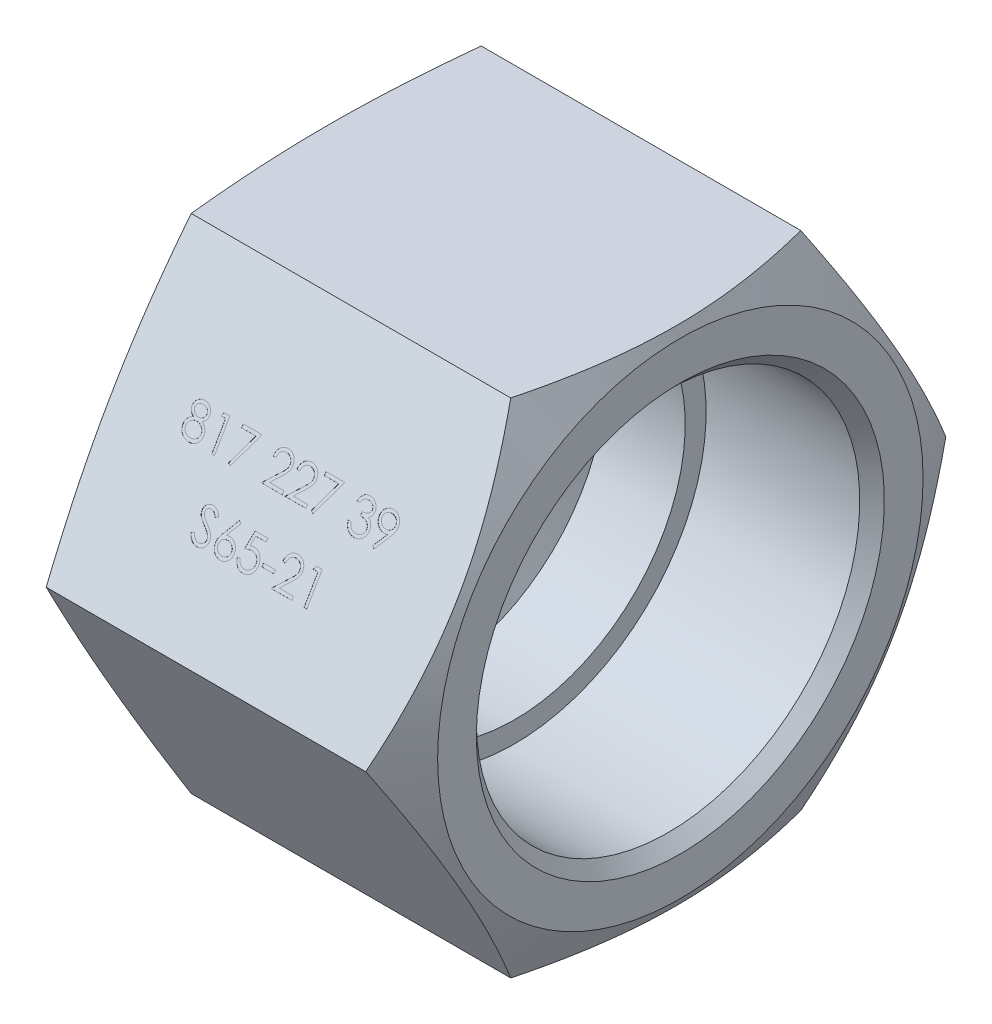
from build123d import *

# Parameters (mm, degrees)
SKETCH2_OUTSIDE_W  = 63.836
SKETCH2_OUTSIDE_H  = 63.836
EXTRUDE1_DEPTH     = 30
CHAMFER1_SIZE      = 1
SKETCH3_W          = 0.961538462
SKETCH3_H          = 0.256410256
CUT_EXTRUDE1_DEPTH = 0.01


with BuildPart() as part:
    # Sketch1 → Revolve1 (revolve)
    with BuildSketch(Plane.XY, mode=Mode.PRIVATE) as revolve1_sk:
        Polygon((0, 0), (0, 14), (2, 23.6), (28, 23.6), (30, 19.75), (30, 15.6), (16.5, 15.6), (16.5, 13.9), (10, 13.9), (4, 1), (4, 0), align=None)
    revolve(revolve1_sk.sketch.rotate(Axis((0, 0, 0), (1, 0, 0)), 90), axis=Axis((0, 0, 0), (1, 0, 0)))

    # Sketch2 outside → Extrude1 (cut)
    with BuildSketch(Plane(origin=(30, 0, 0), x_dir=(0, 0, -1), z_dir=(1, 0, 0))):
        Rectangle(SKETCH2_OUTSIDE_W, SKETCH2_OUTSIDE_H)
        Polygon((11.8, 20.438199529), (-11.8, 20.438199529), (-23.6, 0), (-11.8, -20.438199529), (11.8, -20.438199529), (23.6, 0), align=None, mode=Mode.SUBTRACT)
    extrude(amount=-EXTRUDE1_DEPTH, mode=Mode.SUBTRACT)

    # Chamfer1
    chamfer1_edges = [part.edges().sort_by_distance(p)[0] for p in [
        (30, 0, -15.6),
    ]]
    chamfer(chamfer1_edges, length=CHAMFER1_SIZE)

    # Sketch3 → Cut-Extrude1 (cut)
    # profile 1 of 14: a face of its own
    with BuildSketch(Plane(origin=(0, 10.219099765, 17.7), x_dir=(1, 0, 0), z_dir=(0, 0.49999999999999983, 0.8660254037844389))):
        with BuildLine():
            add(Edge.make_bspline(
                [(8.094256563, 1.392728365), (8.114719811, 1.382058397), (8.154629979, 1.361248395), (8.211470842, 1.327740661), (8.263417271, 1.292425686), (8.31191053, 1.256971501), (8.356098638, 1.220020321), (8.395487504, 1.181425209), (8.43105009, 1.142149534), (8.462069221, 1.10152822), (8.489352676, 1.059669185), (8.512932772, 1.016462561), (8.533087917, 0.972003037), (8.549061445, 0.925805301), (8.562219868, 0.878547972), (8.571273871, 0.829620842), (8.576143098, 0.779346312), (8.577063679, 0.745368954), (8.577529801, 0.728165064)],
                knots=[0, 0, 0, 0, 1.272397273, 2.481599622, 3.635517121, 4.734568067, 5.792894095, 6.808321871, 7.773003508, 8.711915296, 9.623354172, 10.525449501, 11.423591555, 12.311487226, 13.218079475, 14.126165749, 15.051214107, 16, 16, 16, 16], degree=3))
            add(Edge.make_bspline(
                [(8.577529801, 0.728165064), (8.576978786, 0.704095255), (8.575888121, 0.656452072), (8.566388133, 0.586133421), (8.552164577, 0.517839291), (8.531393496, 0.451584654), (8.50445536, 0.387735102), (8.47125762, 0.326235978), (8.433678188, 0.266079329), (8.403498017, 0.22906547), (8.388226916, 0.210336538)],
                knots=[0, 0, 0, 0, 1.025265484, 2.029385089, 3.018602448, 3.995076438, 4.983346944, 5.966715145, 6.97116228, 8, 8, 8, 8], degree=3))
            add(Edge.make_bspline(
                [(8.388226916, 0.210336538), (8.36834372, 0.188483843), (8.32882303, 0.145048491), (8.261120939, 0.088655055), (8.186819594, 0.041262631), (8.106206499, 0.002639849), (8.019497141, -0.027421479), (7.926709995, -0.049023277), (7.827664171, -0.061396441), (7.759588835, -0.063185005), (7.724665217, -0.064102564)],
                knots=[0, 0, 0, 0, 0.954267603, 1.896743057, 2.838368354, 3.796610408, 4.779680527, 5.799409237, 6.871065594, 8, 8, 8, 8], degree=3))
            add(Edge.make_bspline(
                [(7.724665217, -0.064102564), (7.691084225, -0.063279366), (7.625739026, -0.061677505), (7.530626256, -0.050824339), (7.441966921, -0.031804435), (7.359245515, -0.005772571), (7.282960734, 0.028091878), (7.213329947, 0.070240741), (7.149348539, 0.118977486), (7.0929582, 0.175701827), (7.042895026, 0.23645745), (6.998917845, 0.299137172), (6.962364932, 0.363746713), (6.931417007, 0.429322689), (6.907725562, 0.496784228), (6.891316841, 0.565784237), (6.880895902, 0.636202197), (6.879509377, 0.683724806), (6.878811852, 0.707632212)],
                knots=[0, 0, 0, 0, 1.256902934, 2.445805442, 3.576955095, 4.645999104, 5.686449165, 6.692658513, 7.68621702, 8.689161843, 9.678783111, 10.630372946, 11.551080876, 12.453998257, 13.34127905, 14.221779781, 15.105423033, 16, 16, 16, 16], degree=3))
            add(Edge.make_bspline(
                [(6.878811852, 0.707632212), (6.879224624, 0.725174492), (6.880040408, 0.759844229), (6.885686728, 0.811065177), (6.8947642, 0.860919559), (6.907092384, 0.909591519), (6.92380026, 0.956726714), (6.943973212, 1.002548481), (6.967496035, 1.047108551), (6.994696867, 1.090650609), (7.02634117, 1.132564547), (7.062172348, 1.173561686), (7.10290654, 1.213005876), (7.148090582, 1.251379037), (7.197208111, 1.289361876), (7.251534918, 1.324901682), (7.309630824, 1.360514514), (7.350920399, 1.381806175), (7.372101115, 1.392728365)],
                knots=[0, 0, 0, 0, 0.941657376, 1.861047343, 2.762797495, 3.66048619, 4.553285746, 5.444104102, 6.34607688, 7.256116206, 8.197091036, 9.162375105, 10.176350973, 11.237807142, 12.343728897, 13.50695164, 14.721116704, 16, 16, 16, 16], degree=3))
            add(Edge.make_bspline(
                [(7.372101115, 1.392728365), (7.343107276, 1.408538914), (7.286967088, 1.439152563), (7.212631773, 1.495400281), (7.148781327, 1.556320149), (7.097170815, 1.623198574), (7.056547795, 1.693946341), (7.028677363, 1.768120807), (7.009822732, 1.844346603), (7.007954998, 1.896422457), (7.00701698, 1.922576122)],
                knots=[0, 0, 0, 0, 1.166880483, 2.259407225, 3.286803203, 4.280235371, 5.237608625, 6.161067461, 7.076446754, 8, 8, 8, 8], degree=3))
            add(Edge.make_bspline(
                [(7.00701698, 1.922576122), (7.00818514, 1.949217235), (7.010533346, 2.002770518), (7.029521432, 2.082489178), (7.060464336, 2.160786724), (7.102550763, 2.237283662), (7.154970203, 2.309390958), (7.217860593, 2.374063063), (7.289720091, 2.430714122), (7.370189996, 2.478268531), (7.456787307, 2.516971144), (7.548155681, 2.543670018), (7.642703176, 2.561124387), (7.70705869, 2.563100569), (7.739689256, 2.564102564)],
                knots=[0, 0, 0, 0, 0.888701115, 1.786444228, 2.72001202, 3.692817113, 4.693886446, 5.687152267, 6.695133018, 7.739871481, 8.800368666, 9.853104506, 10.91144658, 12, 12, 12, 12], degree=3))
            add(Edge.make_bspline(
                [(7.739689256, 2.564102564), (7.771477695, 2.563069462), (7.834160876, 2.561032302), (7.926299896, 2.544041675), (8.014460522, 2.515663446), (8.098338736, 2.47716543), (8.176432927, 2.429746186), (8.245434576, 2.372316991), (8.306386421, 2.307930169), (8.356803845, 2.235844738), (8.398348766, 2.159641742), (8.427277981, 2.07991137), (8.445815105, 1.998376328), (8.448153223, 1.943206325), (8.449324672, 1.915564904)],
                knots=[0, 0, 0, 0, 1.072916533, 2.115669174, 3.151510826, 4.193348718, 5.225979165, 6.227137561, 7.216255879, 8.211077061, 9.189680878, 10.138522389, 11.067357538, 12, 12, 12, 12], degree=3))
            add(Edge.make_bspline(
                [(8.449324672, 1.915564904), (8.448299986, 1.888438715), (8.446287561, 1.835164423), (8.429359033, 1.757502623), (8.400849523, 1.684772595), (8.361925121, 1.616149058), (8.31119263, 1.552876559), (8.249329249, 1.494150509), (8.176828193, 1.439488489), (8.122356131, 1.408641086), (8.094256563, 1.392728365)],
                knots=[0, 0, 0, 0, 0.975232327, 1.915300861, 2.843280834, 3.77672583, 4.742871857, 5.749627742, 6.839139064, 8, 8, 8, 8], degree=3))
        make_face()
        with BuildLine():
            add(Edge.make_bspline(
                [(7.727169224, 2.307692308), (7.709632934, 2.307226993), (7.675324283, 2.306316634), (7.625018089, 2.301560465), (7.577180684, 2.292308167), (7.531312255, 2.279994802), (7.488041675, 2.263360524), (7.446781279, 2.243792661), (7.408233286, 2.220002614), (7.371932355, 2.193316044), (7.339253231, 2.163963968), (7.31024998, 2.13338274), (7.286158469, 2.100971746), (7.265700534, 2.067537203), (7.250856593, 2.032086792), (7.239739233, 1.99570738), (7.232223953, 1.957939249), (7.231660818, 1.932127455), (7.231375954, 1.919070513)],
                knots=[0, 0, 0, 0, 1.203892937, 2.355340988, 3.463153438, 4.544400666, 5.610487187, 6.640501085, 7.674077295, 8.714426146, 9.728707835, 10.68524104, 11.601827946, 12.495867327, 13.368432065, 14.231010473, 15.105153427, 16, 16, 16, 16], degree=3))
            add(Edge.make_bspline(
                [(7.231375954, 1.919070513), (7.231866931, 1.906013006), (7.232837171, 1.880209497), (7.240340834, 1.842105307), (7.251524301, 1.804661281), (7.269131917, 1.768767773), (7.290250744, 1.733179659), (7.316316084, 1.698786383), (7.347379675, 1.665468251), (7.382399276, 1.63350865), (7.420550374, 1.603580962), (7.460967548, 1.577600118), (7.503143542, 1.555861468), (7.54664502, 1.537769036), (7.591915339, 1.523704795), (7.638677106, 1.513727191), (7.686938179, 1.507525764), (7.719638594, 1.506785035), (7.736183647, 1.506410256)],
                knots=[0, 0, 0, 0, 0.873023192, 1.725219244, 2.590779336, 3.480155217, 4.391973325, 5.357036234, 6.360879153, 7.436073238, 8.526419356, 9.601555421, 10.645666583, 11.697338044, 12.750135903, 13.812665442, 14.89329948, 16, 16, 16, 16], degree=3))
            add(Edge.make_bspline(
                [(7.736183647, 1.506410256), (7.757433721, 1.507033733), (7.799723984, 1.508274528), (7.862066363, 1.519811081), (7.922682538, 1.537958165), (7.980924612, 1.562786712), (8.03528503, 1.593949469), (8.083742222, 1.631258768), (8.12588286, 1.673853123), (8.16126901, 1.721069434), (8.188704615, 1.771320569), (8.210063049, 1.821749349), (8.222535345, 1.8728938), (8.224162179, 1.907155917), (8.224965698, 1.924078526)],
                knots=[0, 0, 0, 0, 1.076279235, 2.141928126, 3.20205304, 4.278698113, 5.344010996, 6.36967002, 7.368914609, 8.37248503, 9.349703398, 10.264243087, 11.142681841, 12, 12, 12, 12], degree=3))
            add(Edge.make_bspline(
                [(8.224965698, 1.924078526), (8.224585771, 1.935955694), (8.223831671, 1.959530171), (8.217617345, 1.994343289), (8.207348893, 2.02836442), (8.193446693, 2.061874614), (8.175153982, 2.094403708), (8.153465277, 2.126463057), (8.127119205, 2.157331459), (8.097550324, 2.18772828), (8.064017889, 2.215859725), (8.026586523, 2.240598804), (7.98544813, 2.26160763), (7.940601737, 2.278671026), (7.892212506, 2.29148699), (7.84050331, 2.301084382), (7.78504299, 2.306493747), (7.746878882, 2.307284122), (7.727169224, 2.307692308)],
                knots=[0, 0, 0, 0, 0.814439003, 1.616544685, 2.417341072, 3.248991801, 4.09997495, 4.973547432, 5.9003056, 6.880240646, 7.880314356, 8.896779544, 9.951930927, 11.043077905, 12.18215768, 13.381699519, 14.647792085, 16, 16, 16, 16], degree=3))
        make_face(mode=Mode.SUBTRACT)
        with BuildLine():
            add(Edge.make_bspline(
                [(7.741692461, 1.25), (7.719459757, 1.249604542), (7.675844617, 1.24882875), (7.611946811, 1.240193392), (7.550623121, 1.228172397), (7.492080309, 1.209936084), (7.436343097, 1.186224305), (7.383109753, 1.157699634), (7.332787517, 1.12398146), (7.286071284, 1.085498163), (7.243411763, 1.044027125), (7.205984406, 1.0001256), (7.174200463, 0.954609505), (7.148605284, 0.906900769), (7.127596904, 0.858009619), (7.113801277, 0.806718479), (7.104957197, 0.754013399), (7.103769603, 0.718184757), (7.103170826, 0.700120192)],
                knots=[0, 0, 0, 0, 1.140299081, 2.23698856, 3.303958914, 4.344563908, 5.37730929, 6.408454204, 7.439741482, 8.480804886, 9.510774543, 10.48932336, 11.43758569, 12.353841022, 13.263987381, 14.161954604, 15.073269652, 16, 16, 16, 16], degree=3))
            add(Edge.make_bspline(
                [(7.103170826, 0.700120192), (7.104144583, 0.677669545), (7.106076492, 0.633127986), (7.121402663, 0.56729722), (7.145999474, 0.503567895), (7.1803032, 0.442459358), (7.222780037, 0.385352139), (7.275013228, 0.335574442), (7.333756684, 0.291344815), (7.400998008, 0.255573005), (7.474446913, 0.227005251), (7.554083862, 0.207322421), (7.638765947, 0.194292814), (7.697237084, 0.192979827), (7.727169224, 0.192307692)],
                knots=[0, 0, 0, 0, 0.898778495, 1.783155532, 2.693654817, 3.627872908, 4.583023416, 5.533784346, 6.509005473, 7.520592997, 8.575161974, 9.658835044, 10.801527049, 12, 12, 12, 12], degree=3))
            add(Edge.make_bspline(
                [(7.727169224, 0.192307692), (7.750562344, 0.192756841), (7.796139643, 0.193631927), (7.862629606, 0.201356423), (7.925375713, 0.213606155), (7.984256283, 0.231422973), (8.039930454, 0.253172957), (8.091454278, 0.281153015), (8.140153226, 0.312976103), (8.1836276, 0.350731929), (8.223222749, 0.391074425), (8.257746529, 0.433781599), (8.287716209, 0.477692765), (8.31123832, 0.523800254), (8.330042787, 0.571219479), (8.343559612, 0.620387701), (8.351899765, 0.671455724), (8.352743262, 0.706097918), (8.353170826, 0.723657853)],
                knots=[0, 0, 0, 0, 1.224942928, 2.386581632, 3.501229538, 4.569074225, 5.605009692, 6.626002462, 7.634866581, 8.645888296, 9.63523824, 10.59253846, 11.518950513, 12.414518923, 13.29783783, 14.186679152, 15.080837789, 16, 16, 16, 16], degree=3))
            add(Edge.make_bspline(
                [(8.353170826, 0.723657853), (8.352523792, 0.740713096), (8.351247952, 0.774343056), (8.343150316, 0.82417629), (8.328924689, 0.872321157), (8.30940512, 0.919356875), (8.283418718, 0.964330412), (8.252815239, 1.008413391), (8.215890869, 1.05038228), (8.174167586, 1.090563063), (8.1286969, 1.127717161), (8.080363225, 1.160584617), (8.029538609, 1.1882647), (7.976330601, 1.210776482), (7.920857347, 1.228481818), (7.863159648, 1.240850386), (7.803169952, 1.248635816), (7.762416473, 1.249540135), (7.741692461, 1.25)],
                knots=[0, 0, 0, 0, 0.917430815, 1.809013306, 2.70690318, 3.612392954, 4.541220862, 5.495268465, 6.494511384, 7.542276156, 8.608045339, 9.649016899, 10.681629292, 11.715607085, 12.752076957, 13.808767841, 14.885711793, 16, 16, 16, 16], degree=3))
        make_face(mode=Mode.SUBTRACT)
    # profile 2 of 14: a face of its own
    with BuildSketch(Plane(origin=(0, 10.219099765, 17.7), x_dir=(1, 0, 0), z_dir=(0, 0.49999999999999983, 0.8660254037844389))):
        Polygon((9.333238935, 2.5), (9.795478519, 2.5), (9.795478519, 0), (9.571119544, 0), (9.571119544, 2.243589744), (9.18650416, 2.243589744), align=None)
    # profile 3 of 14: a face of its own
    with BuildSketch(Plane(origin=(0, 10.219099765, 17.7), x_dir=(1, 0, 0), z_dir=(0, 0.49999999999999983, 0.8660254037844389))):
        Polygon((10.885222108, 2.5), (12.423683647, 2.5), (11.109581083, -0.064102564), (10.915770987, 0.042568109), (12.044076275, 2.243589744), (10.885222108, 2.243589744), align=None)
    # profile 4 of 14: a face of its own
    with BuildSketch(Plane(origin=(0, 10.219099765, 17.7), x_dir=(1, 0, 0), z_dir=(0, 0.49999999999999983, 0.8660254037844389))):
        with BuildLine():
            Line((13.930093903, 1.730769231), (13.705734929, 1.730769231))
            add(Edge.make_bspline(
                [(13.705734929, 1.730769231), (13.707197181, 1.760534151), (13.710069005, 1.818991661), (13.723517783, 1.904223023), (13.742761267, 1.985690736), (13.769969448, 2.062740675), (13.803759647, 2.136054108), (13.844281095, 2.205339834), (13.892276703, 2.27033354), (13.946710084, 2.330432714), (14.00583054, 2.385566693), (14.069620497, 2.433177581), (14.13665266, 2.473404489), (14.206723659, 2.507033947), (14.280624061, 2.532276694), (14.357683246, 2.551006437), (14.438239772, 2.562275255), (14.493125502, 2.563486531), (14.521039416, 2.564102564)],
                knots=[0, 0, 0, 0, 1.10065271, 2.161652631, 3.183658789, 4.190468796, 5.17591951, 6.163126047, 7.15150782, 8.156236427, 9.156009102, 10.134482811, 11.092018607, 12.041330605, 13.001268258, 13.972401359, 14.968799086, 16, 16, 16, 16], degree=3))
            add(Edge.make_bspline(
                [(14.521039416, 2.564102564), (14.548452326, 2.563460809), (14.602317715, 2.562199785), (14.68093344, 2.551370478), (14.755774364, 2.534409341), (14.826694198, 2.510612615), (14.893127101, 2.478623738), (14.955572133, 2.440196925), (15.014772712, 2.395754188), (15.068063272, 2.343430036), (15.116997614, 2.28757119), (15.15921351, 2.227936973), (15.19536577, 2.166344626), (15.225499827, 2.102324482), (15.247682783, 2.035273748), (15.264524361, 1.966168603), (15.274043942, 1.894293738), (15.275504959, 1.845646198), (15.276247749, 1.820913462)],
                knots=[0, 0, 0, 0, 1.111607364, 2.184268762, 3.212621178, 4.221274766, 5.211760367, 6.196651075, 7.1921475, 8.207485113, 9.220403448, 10.201281604, 11.166441695, 12.114753415, 13.065576456, 14.026450734, 14.996634279, 16, 16, 16, 16], degree=3))
            add(Edge.make_bspline(
                [(15.276247749, 1.820913462), (15.275038276, 1.78609358), (15.272640553, 1.717064856), (15.252130285, 1.615625668), (15.220097062, 1.517344654), (15.181527522, 1.438246581), (15.142618633, 1.374508372), (15.107556128, 1.322030725), (15.066509834, 1.265526819), (15.018882336, 1.205185864), (14.965658855, 1.140535217), (14.90635731, 1.071613935), (14.840554823, 0.999134099), (14.79437018, 0.949630098), (14.770438454, 0.923978365)],
                knots=[0, 0, 0, 0, 1.184426356, 2.348067706, 3.509069118, 4.696110526, 5.333549288, 6.050745305, 6.844228056, 7.710549037, 8.667450064, 9.695053472, 10.805634456, 12, 12, 12, 12], degree=3))
            Line((14.770438454, 0.923978365), (14.144937653, 0.256410256))
            Line((14.144937653, 0.256410256), (15.308299031, 0.256410256))
            Line((15.308299031, 0.256410256), (15.308299031, 0))
            Line((15.308299031, 0), (13.609581083, 0))
            Line((13.609581083, 0), (14.579132365, 1.034655449))
            add(Edge.make_bspline(
                [(14.579132365, 1.034655449), (14.602737998, 1.059297096), (14.648079589, 1.106628658), (14.712210001, 1.175730772), (14.769809278, 1.239837587), (14.821250273, 1.298827979), (14.865417063, 1.353564813), (14.904611514, 1.402275316), (14.936015508, 1.447099923), (14.970097933, 1.499057504), (15.00310792, 1.562494874), (15.031473888, 1.640018938), (15.048770209, 1.719824118), (15.050845091, 1.773754145), (15.051888775, 1.80088141)],
                knots=[0, 0, 0, 0, 1.329631726, 2.553950428, 3.673215718, 4.687767853, 5.603093632, 6.413772471, 7.123043292, 7.734684054, 8.834405432, 9.900288307, 10.943827018, 12, 12, 12, 12], degree=3))
            add(Edge.make_bspline(
                [(15.051888775, 1.80088141), (15.051434673, 1.817939552), (15.050539726, 1.851557874), (15.042641371, 1.900847702), (15.030705295, 1.948393997), (15.013601539, 1.994343011), (14.991025296, 2.038232762), (14.963544311, 2.080116677), (14.931837123, 2.120608795), (14.895157644, 2.158575436), (14.854863702, 2.193347726), (14.812296381, 2.224150644), (14.767260592, 2.249892866), (14.719946219, 2.270995364), (14.670485169, 2.287549208), (14.61878178, 2.299019622), (14.564978911, 2.306221396), (14.5282407, 2.307195804), (14.509520987, 2.307692308)],
                knots=[0, 0, 0, 0, 0.991446411, 1.95395049, 2.89581595, 3.838931463, 4.798493298, 5.75982156, 6.748411868, 7.785213223, 8.824556874, 9.840280684, 10.836137867, 11.835679398, 12.848801643, 13.863922112, 14.911575587, 16, 16, 16, 16], degree=3))
            add(Edge.make_bspline(
                [(14.509520987, 2.307692308), (14.489970392, 2.30718157), (14.451576252, 2.306178567), (14.395205514, 2.299162378), (14.341429958, 2.287058206), (14.290114313, 2.270503439), (14.241171752, 2.249461618), (14.194840292, 2.223253229), (14.151223943, 2.191979306), (14.110240712, 2.156521765), (14.072480727, 2.117044907), (14.039304387, 2.073037791), (14.010315805, 2.025303923), (13.985023496, 1.973972101), (13.964483717, 1.918576544), (13.948788609, 1.859313897), (13.936369433, 1.796441482), (13.93222049, 1.753023564), (13.930093903, 1.730769231)],
                knots=[0, 0, 0, 0, 1.031018746, 2.02475058, 2.990194455, 3.934040569, 4.864654155, 5.795059489, 6.735614925, 7.690564532, 8.649604399, 9.611025574, 10.590972636, 11.591080095, 12.624614302, 13.701020113, 14.821632451, 16, 16, 16, 16], degree=3))
        make_face()
    # profile 5 of 14: a face of its own
    with BuildSketch(Plane(origin=(0, 10.219099765, 17.7), x_dir=(1, 0, 0), z_dir=(0, 0.49999999999999983, 0.8660254037844389))):
        with BuildLine():
            Line((15.853170826, 1.730769231), (15.628811852, 1.730769231))
            add(Edge.make_bspline(
                [(15.628811852, 1.730769231), (15.630274104, 1.760534151), (15.633145928, 1.818991661), (15.646594706, 1.904223023), (15.66583819, 1.985690736), (15.693046372, 2.062740675), (15.72683657, 2.136054108), (15.767358018, 2.205339834), (15.815353626, 2.27033354), (15.869787007, 2.330432714), (15.928907464, 2.385566693), (15.99269742, 2.433177581), (16.059729583, 2.473404489), (16.129800582, 2.507033947), (16.203700984, 2.532276694), (16.280760169, 2.551006437), (16.361316695, 2.562275255), (16.416202425, 2.563486531), (16.444116339, 2.564102564)],
                knots=[0, 0, 0, 0, 1.10065271, 2.161652631, 3.183658789, 4.190468796, 5.17591951, 6.163126047, 7.15150782, 8.156236427, 9.156009102, 10.134482811, 11.092018607, 12.041330605, 13.001268258, 13.972401359, 14.968799086, 16, 16, 16, 16], degree=3))
            add(Edge.make_bspline(
                [(16.444116339, 2.564102564), (16.471529249, 2.563460809), (16.525394638, 2.562199785), (16.604010363, 2.551370478), (16.678851287, 2.534409341), (16.749771121, 2.510612615), (16.816204024, 2.478623738), (16.878649056, 2.440196925), (16.937849635, 2.395754188), (16.991140195, 2.343430036), (17.040074537, 2.28757119), (17.082290433, 2.227936973), (17.118442693, 2.166344626), (17.14857675, 2.102324482), (17.170759707, 2.035273748), (17.187601284, 1.966168603), (17.197120865, 1.894293738), (17.198581882, 1.845646198), (17.199324672, 1.820913462)],
                knots=[0, 0, 0, 0, 1.111607364, 2.184268762, 3.212621178, 4.221274766, 5.211760367, 6.196651075, 7.1921475, 8.207485113, 9.220403448, 10.201281604, 11.166441695, 12.114753415, 13.065576456, 14.026450734, 14.996634279, 16, 16, 16, 16], degree=3))
            add(Edge.make_bspline(
                [(17.199324672, 1.820913462), (17.198115199, 1.78609358), (17.195717477, 1.717064856), (17.175207208, 1.615625668), (17.143173985, 1.517344654), (17.104604445, 1.438246581), (17.065695556, 1.374508372), (17.030633051, 1.322030725), (16.989586757, 1.265526819), (16.941959259, 1.205185864), (16.888735778, 1.140535217), (16.829434233, 1.071613935), (16.763631746, 0.999134099), (16.717447103, 0.949630098), (16.693515378, 0.923978365)],
                knots=[0, 0, 0, 0, 1.184426356, 2.348067706, 3.509069118, 4.696110526, 5.333549288, 6.050745305, 6.844228056, 7.710549037, 8.667450064, 9.695053472, 10.805634456, 12, 12, 12, 12], degree=3))
            Line((16.693515378, 0.923978365), (16.068014576, 0.256410256))
            Line((16.068014576, 0.256410256), (17.231375954, 0.256410256))
            Line((17.231375954, 0.256410256), (17.231375954, 0))
            Line((17.231375954, 0), (15.532658006, 0))
            Line((15.532658006, 0), (16.502209288, 1.034655449))
            add(Edge.make_bspline(
                [(16.502209288, 1.034655449), (16.525814921, 1.059297096), (16.571156512, 1.106628658), (16.635286924, 1.175730772), (16.692886201, 1.239837587), (16.744327196, 1.298827979), (16.788493986, 1.353564813), (16.827688437, 1.402275316), (16.859092431, 1.447099923), (16.893174856, 1.499057504), (16.926184843, 1.562494874), (16.954550812, 1.640018938), (16.971847132, 1.719824118), (16.973922014, 1.773754145), (16.974965698, 1.80088141)],
                knots=[0, 0, 0, 0, 1.329631726, 2.553950428, 3.673215718, 4.687767853, 5.603093632, 6.413772471, 7.123043292, 7.734684054, 8.834405432, 9.900288307, 10.943827018, 12, 12, 12, 12], degree=3))
            add(Edge.make_bspline(
                [(16.974965698, 1.80088141), (16.974511596, 1.817939552), (16.973616649, 1.851557874), (16.965718294, 1.900847702), (16.953782218, 1.948393997), (16.936678462, 1.994343011), (16.914102219, 2.038232762), (16.886621234, 2.080116677), (16.854914046, 2.120608795), (16.818234568, 2.158575436), (16.777940625, 2.193347726), (16.735373304, 2.224150644), (16.690337515, 2.249892866), (16.643023142, 2.270995364), (16.593562092, 2.287549208), (16.541858703, 2.299019622), (16.488055834, 2.306221396), (16.451317623, 2.307195804), (16.43259791, 2.307692308)],
                knots=[0, 0, 0, 0, 0.991446411, 1.95395049, 2.89581595, 3.838931463, 4.798493298, 5.75982156, 6.748411868, 7.785213223, 8.824556874, 9.840280684, 10.836137867, 11.835679398, 12.848801643, 13.863922112, 14.911575587, 16, 16, 16, 16], degree=3))
            add(Edge.make_bspline(
                [(16.43259791, 2.307692308), (16.413047315, 2.30718157), (16.374653175, 2.306178567), (16.318282437, 2.299162378), (16.264506881, 2.287058206), (16.213191236, 2.270503439), (16.164248675, 2.249461618), (16.117917215, 2.223253229), (16.074300866, 2.191979306), (16.033317635, 2.156521765), (15.99555765, 2.117044907), (15.96238131, 2.073037791), (15.933392728, 2.025303923), (15.908100419, 1.973972101), (15.88756064, 1.918576544), (15.871865533, 1.859313897), (15.859446356, 1.796441482), (15.855297413, 1.753023564), (15.853170826, 1.730769231)],
                knots=[0, 0, 0, 0, 1.031018746, 2.02475058, 2.990194455, 3.934040569, 4.864654155, 5.795059489, 6.735614925, 7.690564532, 8.649604399, 9.611025574, 10.590972636, 11.591080095, 12.624614302, 13.701020113, 14.821632451, 16, 16, 16, 16], degree=3))
        make_face()
    # profile 6 of 14: a face of its own
    with BuildSketch(Plane(origin=(0, 10.219099765, 17.7), x_dir=(1, 0, 0), z_dir=(0, 0.49999999999999983, 0.8660254037844389))):
        Polygon((17.615991339, 2.5), (19.154452878, 2.5), (17.840350313, -0.064102564), (17.646540217, 0.042568109), (18.774845506, 2.243589744), (17.615991339, 2.243589744), align=None)
    # profile 7 of 14: a face of its own
    with BuildSketch(Plane(origin=(0, 10.219099765, 17.7), x_dir=(1, 0, 0), z_dir=(0, 0.49999999999999983, 0.8660254037844389))):
        with BuildLine():
            Line((20.660863134, 1.923076923), (20.43650416, 1.923076923))
            add(Edge.make_bspline(
                [(20.43650416, 1.923076923), (20.44258241, 1.948242983), (20.454464893, 1.997440572), (20.479248874, 2.067731473), (20.506248342, 2.134248274), (20.538669131, 2.195745469), (20.574032527, 2.253458971), (20.614548756, 2.306079774), (20.658348558, 2.354946178), (20.70679495, 2.398312776), (20.757601137, 2.437582583), (20.811483009, 2.471064767), (20.867356504, 2.499867733), (20.925608742, 2.52359647), (20.98641315, 2.541471844), (21.049220024, 2.554440991), (21.114193953, 2.562863215), (21.158299374, 2.563685189), (21.180694865, 2.564102564)],
                knots=[0, 0, 0, 0, 1.162005537, 2.271625781, 3.343758855, 4.383309926, 5.390229558, 6.379919256, 7.361854164, 8.333198761, 9.295911338, 10.242430842, 11.177959212, 12.116337295, 13.062827104, 14.020064771, 14.994644689, 16, 16, 16, 16], degree=3))
            add(Edge.make_bspline(
                [(21.180694865, 2.564102564), (21.213325395, 2.5631174), (21.277874688, 2.56116856), (21.372705436, 2.543372534), (21.464153164, 2.515211725), (21.551216913, 2.47630192), (21.632087222, 2.428310982), (21.704041641, 2.371193313), (21.766104863, 2.306050955), (21.818172275, 2.234099123), (21.858940132, 2.157202331), (21.889001827, 2.078059361), (21.907303028, 1.996857953), (21.909674854, 1.942031325), (21.910863134, 1.914563301)],
                knots=[0, 0, 0, 0, 1.083050992, 2.142477498, 3.193116406, 4.255571735, 5.30263384, 6.308962982, 7.297363603, 8.282367274, 9.249857812, 10.179914175, 11.08814088, 12, 12, 12, 12], degree=3))
            add(Edge.make_bspline(
                [(21.910863134, 1.914563301), (21.910031997, 1.888129876), (21.908405592, 1.836403766), (21.894595803, 1.760888411), (21.871355615, 1.689715839), (21.839162927, 1.622586438), (21.797490392, 1.559925838), (21.747009894, 1.501593059), (21.687365135, 1.447329374), (21.642165894, 1.416244037), (21.618895987, 1.400240385)],
                knots=[0, 0, 0, 0, 1.024540389, 2.004866551, 2.965041327, 3.920577974, 4.882998113, 5.874504559, 6.905732034, 8, 8, 8, 8], degree=3))
            add(Edge.make_bspline(
                [(21.618895987, 1.400240385), (21.645490097, 1.387398834), (21.698180721, 1.361956007), (21.770002528, 1.312059037), (21.835201011, 1.25444736), (21.87156081, 1.209488323), (21.88982948, 1.186899038)],
                knots=[0, 0, 0, 0, 1.015518401, 2.012035669, 3.001164323, 4, 4, 4, 4], degree=3))
            add(Edge.make_bspline(
                [(21.88982948, 1.186899038), (21.90185901, 1.170429216), (21.925721079, 1.137759275), (21.955175032, 1.085233257), (21.981895828, 1.03212505), (22.002717413, 0.977011189), (22.018841603, 0.920530465), (22.030367341, 0.862585896), (22.037527441, 0.803130166), (22.038552836, 0.762906966), (22.039068262, 0.742688301)],
                knots=[0, 0, 0, 0, 1.025084078, 2.033381695, 3.024893161, 4.013698104, 4.991890475, 5.976764909, 6.982997093, 8, 8, 8, 8], degree=3))
            add(Edge.make_bspline(
                [(22.039068262, 0.742688301), (22.037786467, 0.707681358), (22.035228908, 0.637832213), (22.012368855, 0.534635984), (21.976930826, 0.433760625), (21.926604443, 0.337278597), (21.865270508, 0.247006896), (21.792300991, 0.166238104), (21.708524985, 0.096810529), (21.615092379, 0.038803224), (21.513865858, -0.007566721), (21.405597578, -0.039750608), (21.29184754, -0.060712037), (21.213842327, -0.0629598), (21.174184448, -0.064102564)],
                knots=[0, 0, 0, 0, 0.955779014, 1.907060117, 2.875433937, 3.871313158, 4.872415639, 5.851225146, 6.836215519, 7.83643374, 8.849228613, 9.86973379, 10.916971861, 12, 12, 12, 12], degree=3))
            add(Edge.make_bspline(
                [(21.174184448, -0.064102564), (21.147456376, -0.063482412), (21.094864444, -0.062262159), (21.01754766, -0.053920301), (20.943746446, -0.038684583), (20.873361019, -0.018182222), (20.80632885, 0.00781188), (20.742854489, 0.040182378), (20.682547422, 0.078262023), (20.625976743, 0.1225003), (20.573149195, 0.171986971), (20.525468677, 0.227600549), (20.482140254, 0.288312981), (20.444324083, 0.354829449), (20.410297688, 0.426290348), (20.382311291, 0.503610704), (20.357678742, 0.586099291), (20.346226267, 0.643583391), (20.340350313, 0.673076923)],
                knots=[0, 0, 0, 0, 1.048658725, 2.063410685, 3.046034179, 4.001477787, 4.936774919, 5.862367409, 6.792675028, 7.730719943, 8.675894397, 9.627829632, 10.600096036, 11.597688215, 12.626045268, 13.701542398, 14.82072376, 16, 16, 16, 16], degree=3))
            Line((20.340350313, 0.673076923), (20.564709288, 0.673076923))
            add(Edge.make_bspline(
                [(20.564709288, 0.673076923), (20.570554496, 0.653827628), (20.581923934, 0.616386077), (20.601277004, 0.562500144), (20.623325769, 0.513101535), (20.646979026, 0.467827876), (20.671820773, 0.426233303), (20.699617148, 0.389417682), (20.728309394, 0.355763966), (20.749937504, 0.336803529), (20.760522589, 0.327524038)],
                knots=[0, 0, 0, 0, 1.198163088, 2.33053128, 3.407730985, 4.417276592, 5.372219308, 6.28897303, 7.162600585, 8, 8, 8, 8], degree=3))
            add(Edge.make_bspline(
                [(20.760522589, 0.327524038), (20.774520144, 0.316732371), (20.802472046, 0.295182349), (20.848020782, 0.267681185), (20.895924272, 0.243851882), (20.947220468, 0.225649242), (21.000802447, 0.210236627), (21.057536279, 0.200150542), (21.116921435, 0.19323042), (21.157469837, 0.192619754), (21.178190858, 0.192307692)],
                knots=[0, 0, 0, 0, 0.946170439, 1.889420265, 2.845303464, 3.807233317, 4.801018734, 5.828864929, 6.890507805, 8, 8, 8, 8], degree=3))
            add(Edge.make_bspline(
                [(21.178190858, 0.192307692), (21.201586217, 0.192747625), (21.247333822, 0.193607874), (21.314087293, 0.201519093), (21.377592613, 0.213040817), (21.437144703, 0.230835805), (21.493523637, 0.252822128), (21.545939101, 0.280428131), (21.595079176, 0.312817218), (21.640314466, 0.349630903), (21.680989829, 0.389931971), (21.716803767, 0.432084165), (21.747249953, 0.475909757), (21.771809652, 0.521651272), (21.791202902, 0.569119293), (21.804405188, 0.618447028), (21.813584842, 0.66923079), (21.814332422, 0.703751482), (21.814709288, 0.721153846)],
                knots=[0, 0, 0, 0, 1.217147791, 2.380027433, 3.494444702, 4.572153297, 5.609568379, 6.639424714, 7.649109417, 8.668170816, 9.669597737, 10.625200337, 11.543417969, 12.441394052, 13.322311151, 14.205496177, 15.095365482, 16, 16, 16, 16], degree=3))
            add(Edge.make_bspline(
                [(21.814709288, 0.721153846), (21.813616215, 0.74444766), (21.811435509, 0.79091938), (21.794786524, 0.859289076), (21.767401621, 0.925162942), (21.729064113, 0.987417078), (21.682395735, 1.04511415), (21.627849373, 1.09659378), (21.564972067, 1.139072417), (21.507100732, 1.168421457), (21.455839906, 1.188447939), (21.411971774, 1.2017872), (21.362859915, 1.213082668), (21.309098237, 1.223591433), (21.250281654, 1.232535254), (21.186474198, 1.239993693), (21.11766294, 1.24596158), (21.070026393, 1.248626648), (21.045478519, 1.25)],
                knots=[0, 0, 0, 0, 1.07054697, 2.135767047, 3.216561865, 4.33974944, 5.486079747, 6.621378074, 7.775625952, 8.963672916, 9.598146892, 10.304877434, 11.070270905, 11.915000392, 12.823868403, 13.805723172, 14.86925407, 16, 16, 16, 16], degree=3))
            Line((21.045478519, 1.25), (21.045478519, 1.506410256))
            add(Edge.make_bspline(
                [(21.045478519, 1.506410256), (21.076407923, 1.506935116), (21.136991027, 1.507963188), (21.225486959, 1.520397481), (21.310110754, 1.537597929), (21.388986998, 1.563944495), (21.460878936, 1.594544707), (21.52325008, 1.630153428), (21.575226614, 1.669735392), (21.616555951, 1.713901542), (21.647648257, 1.761269433), (21.670381684, 1.810638474), (21.683810488, 1.862441375), (21.685603108, 1.897794709), (21.68650416, 1.915564904)],
                knots=[0, 0, 0, 0, 1.321986639, 2.589447074, 3.816329219, 5.01088745, 6.139805852, 7.153945165, 8.075214402, 8.924034688, 9.728124013, 10.488707548, 11.240355623, 12, 12, 12, 12], degree=3))
            add(Edge.make_bspline(
                [(21.68650416, 1.915564904), (21.686208152, 1.928620436), (21.685619258, 1.954593798), (21.678192631, 1.992540276), (21.667032602, 2.029326666), (21.651689938, 2.06479653), (21.631154082, 2.098703869), (21.606578377, 2.131337761), (21.577315449, 2.162511889), (21.543782986, 2.19156926), (21.507774554, 2.219261572), (21.468310429, 2.242771313), (21.426580519, 2.262874929), (21.382538622, 2.279453144), (21.336041815, 2.291924065), (21.28730856, 2.300878237), (21.236245928, 2.306476562), (21.201408977, 2.307282573), (21.183699672, 2.307692308)],
                knots=[0, 0, 0, 0, 0.884392785, 1.759457502, 2.611959086, 3.489218968, 4.37281399, 5.2945488, 6.255912374, 7.266815255, 8.301784654, 9.332968512, 10.37626691, 11.440494194, 12.520033166, 13.637162961, 14.798855837, 16, 16, 16, 16], degree=3))
            add(Edge.make_bspline(
                [(21.183699672, 2.307692308), (21.155234195, 2.306698478), (21.099634498, 2.304757297), (21.019480986, 2.287755144), (20.944967176, 2.260627942), (20.888010985, 2.228247213), (20.845952004, 2.196282618), (20.815897048, 2.168366628), (20.786382398, 2.137343182), (20.759349771, 2.101301485), (20.732011217, 2.06268235), (20.707122244, 2.019522577), (20.68293675, 1.97294801), (20.6683635, 1.940022556), (20.660863134, 1.923076923)],
                knots=[0, 0, 0, 0, 1.472543308, 2.876219568, 4.221790263, 5.565193594, 6.249813518, 6.953379497, 7.687249741, 8.463570142, 9.283606569, 10.136032583, 11.040678096, 12, 12, 12, 12], degree=3))
        make_face()
    # profile 8 of 14: a face of its own
    with BuildSketch(Plane(origin=(0, 10.219099765, 17.7), x_dir=(1, 0, 0), z_dir=(0, 0.49999999999999983, 0.8660254037844389))):
        with BuildLine():
            Line((22.808299031, -0.064102564), (22.629012172, 0.060596955))
            Line((22.629012172, 0.060596955), (23.324124352, 1.076722756))
            add(Edge.make_bspline(
                [(23.324124352, 1.076722756), (23.279773826, 1.07129914), (23.192445169, 1.060619736), (23.104490096, 1.05865784), (23.061203679, 1.057692308)],
                knots=[0, 0, 0, 0, 1.015715272, 2, 2, 2, 2], degree=3))
            add(Edge.make_bspline(
                [(23.061203679, 1.057692308), (23.034959359, 1.058364505), (22.983444054, 1.05968397), (22.907707159, 1.070142405), (22.834931759, 1.086249639), (22.765310791, 1.110284464), (22.698582573, 1.140154613), (22.634892777, 1.177195337), (22.574327141, 1.22077126), (22.517536134, 1.270651968), (22.465884892, 1.325422005), (22.419868251, 1.383390322), (22.381624585, 1.445230301), (22.349855596, 1.509680458), (22.325762415, 1.577667137), (22.308217745, 1.648416708), (22.297416063, 1.722425024), (22.296130995, 1.772800117), (22.295478519, 1.798377404)],
                knots=[0, 0, 0, 0, 1.060718605, 2.082097864, 3.085795603, 4.069760067, 5.054557537, 6.03741023, 7.043284206, 8.066802108, 9.088538119, 10.083643548, 11.053783639, 12.022749082, 12.983451788, 13.964007469, 14.966251758, 16, 16, 16, 16], degree=3))
            add(Edge.make_bspline(
                [(22.295478519, 1.798377404), (22.296717401, 1.833355013), (22.299149075, 1.902008964), (22.318719444, 2.002318799), (22.350905401, 2.09716633), (22.395782813, 2.186302183), (22.452307614, 2.26844414), (22.520242321, 2.342450289), (22.599173724, 2.407268042), (22.687303738, 2.46298524), (22.782555895, 2.507795952), (22.882319222, 2.540824024), (22.985829308, 2.560251701), (23.055949073, 2.56281303), (23.091251756, 2.564102564)],
                knots=[0, 0, 0, 0, 1.022988612, 2.007919123, 2.978103895, 3.94594894, 4.918897164, 5.887013414, 6.875921846, 7.89917871, 8.930658928, 9.948724884, 10.967259574, 12, 12, 12, 12], degree=3))
            add(Edge.make_bspline(
                [(23.091251756, 2.564102564), (23.125886341, 2.562795305), (23.194321017, 2.560212284), (23.294956022, 2.541295163), (23.391342463, 2.509411825), (23.482946025, 2.465351422), (23.567759891, 2.410122203), (23.644028327, 2.344311829), (23.710010855, 2.267879309), (23.765599341, 2.182673245), (23.810220799, 2.091125401), (23.842415287, 1.995565456), (23.8622336, 1.896680655), (23.864730977, 1.829684603), (23.865991339, 1.795873397)],
                knots=[0, 0, 0, 0, 1.026385292, 2.028040595, 3.023318987, 4.028184125, 5.03290303, 6.015178782, 7.004435299, 8.016004309, 9.023023918, 10.015172535, 10.998308025, 12, 12, 12, 12], degree=3))
            add(Edge.make_bspline(
                [(23.865991339, 1.795873397), (23.865149618, 1.769627849), (23.863442399, 1.71639532), (23.851487894, 1.635516504), (23.831187761, 1.55305134), (23.808150834, 1.4832502), (23.785913571, 1.425601308), (23.764984191, 1.380064465), (23.741761224, 1.332134991), (23.714676392, 1.282315464), (23.685560466, 1.229970796), (23.652660982, 1.175625999), (23.616728431, 1.119208147), (23.591135774, 1.081174513), (23.578030602, 1.061698718)],
                knots=[0, 0, 0, 0, 1.179839688, 2.393009684, 3.667231171, 4.993948276, 5.694988576, 6.444077775, 7.246288328, 8.089075292, 8.993003841, 9.939041771, 10.944649915, 12, 12, 12, 12], degree=3))
            Line((23.578030602, 1.061698718), (22.808299031, -0.064102564))
        make_face()
        with BuildLine():
            add(Edge.make_bspline(
                [(23.102770185, 1.314102564), (23.122651624, 1.314645695), (23.161354026, 1.315702987), (23.218052097, 1.32213816), (23.271569385, 1.33354815), (23.322048849, 1.349919373), (23.369996636, 1.369674137), (23.414651156, 1.394825555), (23.456049781, 1.424837437), (23.494469729, 1.458558877), (23.528586872, 1.49602358), (23.558974751, 1.535235799), (23.584803728, 1.576367663), (23.605206068, 1.619934279), (23.621980765, 1.664875142), (23.633565059, 1.711913967), (23.63998244, 1.760805682), (23.641076422, 1.794019009), (23.641632365, 1.810897436)],
                knots=[0, 0, 0, 0, 1.163407946, 2.26475976, 3.333800367, 4.359385343, 5.366239384, 6.363380779, 7.350133999, 8.353570782, 9.349036268, 10.310270964, 11.253520213, 12.184142, 13.120487599, 14.056272588, 15.012232024, 16, 16, 16, 16], degree=3))
            add(Edge.make_bspline(
                [(23.641632365, 1.810897436), (23.64115403, 1.827782911), (23.640211412, 1.861057811), (23.632649055, 1.910021911), (23.619345324, 1.956945669), (23.601494978, 2.002085976), (23.577980522, 2.045071956), (23.549763746, 2.086443293), (23.516240568, 2.12593767), (23.477667307, 2.162626229), (23.436071197, 2.196446157), (23.391742269, 2.226293355), (23.3450459, 2.251308495), (23.296266979, 2.271950616), (23.245303872, 2.288059027), (23.192186738, 2.299642859), (23.136647162, 2.306051255), (23.098946244, 2.307138323), (23.079733326, 2.307692308)],
                knots=[0, 0, 0, 0, 0.972161553, 1.915763587, 2.844109794, 3.775983486, 4.705125789, 5.659731448, 6.655561913, 7.682237399, 8.721216875, 9.739758359, 10.754845918, 11.767244016, 12.7857855, 13.828538656, 14.893392813, 16, 16, 16, 16], degree=3))
            add(Edge.make_bspline(
                [(23.079733326, 2.307692308), (23.060687502, 2.307137428), (23.023319753, 2.306048758), (22.968273925, 2.29965504), (22.915515948, 2.287981123), (22.864700505, 2.271958078), (22.815923033, 2.251306955), (22.769228867, 2.226292044), (22.724889569, 2.196453028), (22.68333334, 2.162599619), (22.644691967, 2.126108443), (22.61174516, 2.08627028), (22.583463809, 2.045093476), (22.559981664, 2.002080256), (22.542122723, 1.956947195), (22.528821293, 1.910021497), (22.521258318, 1.861057919), (22.520315785, 1.827782947), (22.519837493, 1.810897436)],
                knots=[0, 0, 0, 0, 1.099389452, 2.15699305, 3.192601482, 4.213358962, 5.227959689, 6.245255729, 7.266013209, 8.307253147, 9.336162325, 10.327954924, 11.284637477, 12.215801273, 13.149702402, 14.080068371, 15.025723358, 16, 16, 16, 16], degree=3))
            add(Edge.make_bspline(
                [(22.519837493, 1.810897436), (22.520270297, 1.794005865), (22.521123867, 1.760692597), (22.529358002, 1.711745173), (22.543128202, 1.664825035), (22.561570624, 1.619475958), (22.585857474, 1.576138917), (22.615660223, 1.535019372), (22.650592756, 1.495651194), (22.690188104, 1.458646042), (22.733522505, 1.424680203), (22.779805895, 1.395015644), (22.828241492, 1.369963898), (22.8789998, 1.34986291), (22.931704657, 1.333711721), (22.986829751, 1.322159189), (23.044192778, 1.315764713), (23.08305705, 1.314661929), (23.102770185, 1.314102564)],
                knots=[0, 0, 0, 0, 0.952633368, 1.87876736, 2.791047057, 3.707742249, 4.635551637, 5.587206343, 6.568248508, 7.601284464, 8.641511608, 9.671105535, 10.699146789, 11.713763218, 12.747829548, 13.806491675, 14.887386225, 16, 16, 16, 16], degree=3))
        make_face(mode=Mode.SUBTRACT)
    # profile 9 of 14: a face of its own
    with BuildSketch(Plane(origin=(0, 10.219099765, 17.7), x_dir=(1, 0, 0), z_dir=(0, 0.49999999999999983, 0.8660254037844389))):
        with BuildLine():
            Line((10.212145185, -4.684395032), (10.423483326, -4.557692308))
            add(Edge.make_bspline(
                [(10.423483326, -4.557692308), (10.44313921, -4.59059544), (10.480799125, -4.653636571), (10.543621524, -4.738820886), (10.608716461, -4.811222426), (10.676565985, -4.870420003), (10.746755948, -4.917026351), (10.819744557, -4.950027945), (10.895285851, -4.970610784), (10.946695723, -4.973110846), (10.972361531, -4.974358974)],
                knots=[0, 0, 0, 0, 1.272034388, 2.437168799, 3.508375237, 4.49857839, 5.41946034, 6.295179144, 7.148887113, 8, 8, 8, 8], degree=3))
            add(Edge.make_bspline(
                [(10.972361531, -4.974358974), (10.994280717, -4.973748494), (11.037735555, -4.972538215), (11.101708586, -4.960909071), (11.163838445, -4.943043265), (11.222844615, -4.917456885), (11.277912911, -4.886500824), (11.326203407, -4.849110697), (11.367950631, -4.807249121), (11.402099999, -4.760547225), (11.428300024, -4.71032069), (11.448437216, -4.65876644), (11.459612268, -4.605074605), (11.461295663, -4.568924274), (11.462145185, -4.55068109)],
                knots=[0, 0, 0, 0, 1.095163259, 2.171163733, 3.241058638, 4.321873601, 5.38011039, 6.391990106, 7.366004449, 8.327778327, 9.272591725, 10.192022065, 11.087607919, 12, 12, 12, 12], degree=3))
            add(Edge.make_bspline(
                [(11.462145185, -4.55068109), (11.461092106, -4.529866197), (11.45895135, -4.487552562), (11.440857436, -4.425124238), (11.412393688, -4.363343831), (11.386134657, -4.325128642), (11.372501756, -4.305288462)],
                knots=[0, 0, 0, 0, 0.938893495, 1.908633276, 2.914225137, 4, 4, 4, 4], degree=3))
            add(Edge.make_bspline(
                [(11.372501756, -4.305288462), (11.36130846, -4.290969302), (11.337809535, -4.260908017), (11.297411312, -4.21616142), (11.250006945, -4.170005407), (11.197218691, -4.120677509), (11.137123628, -4.07047194), (11.071603975, -4.016994599), (10.998986933, -3.962279186), (10.948058721, -3.925584497), (10.921780602, -3.906650641)],
                knots=[0, 0, 0, 0, 0.722233717, 1.516239348, 2.393582979, 3.351407094, 4.387010283, 5.505090956, 6.712668013, 8, 8, 8, 8], degree=3))
            add(Edge.make_bspline(
                [(10.921780602, -3.906650641), (10.895477747, -3.887915936), (10.845188693, -3.852096605), (10.774861134, -3.798936403), (10.711972232, -3.750333639), (10.656801506, -3.705830773), (10.609373222, -3.665421769), (10.569313643, -3.62949467), (10.537643245, -3.597077841), (10.520032116, -3.576048311), (10.512125153, -3.566606571)],
                knots=[0, 0, 0, 0, 1.452282411, 2.77665338, 3.964542531, 5.026858415, 5.96415736, 6.766646006, 7.446254459, 8, 8, 8, 8], degree=3))
            add(Edge.make_bspline(
                [(10.512125153, -3.566606571), (10.501073335, -3.551891544), (10.479338452, -3.52295247), (10.450648448, -3.477720429), (10.426263332, -3.431418096), (10.40714738, -3.38392105), (10.391050081, -3.335896101), (10.380222988, -3.28671664), (10.373443418, -3.236603341), (10.372749142, -3.202879412), (10.372401595, -3.185997596)],
                knots=[0, 0, 0, 0, 1.068054152, 2.10047183, 3.106115577, 4.101338837, 5.06977816, 6.043150881, 7.020423561, 8, 8, 8, 8], degree=3))
            add(Edge.make_bspline(
                [(10.372401595, -3.185997596), (10.373333888, -3.159547757), (10.375178545, -3.107213426), (10.390778914, -3.030762833), (10.41540241, -2.957772535), (10.449898758, -2.888965154), (10.494368296, -2.82613231), (10.545829706, -2.768551248), (10.607123625, -2.720145118), (10.674375499, -2.67785079), (10.747987193, -2.644746558), (10.825123553, -2.619774429), (10.905907176, -2.60562496), (10.9606237, -2.603594413), (10.988387172, -2.602564103)],
                knots=[0, 0, 0, 0, 1.005424448, 1.989358655, 2.955360095, 3.929531133, 4.905563448, 5.876582895, 6.856512386, 7.866279853, 8.892233794, 9.918561126, 10.94386622, 12, 12, 12, 12], degree=3))
            add(Edge.make_bspline(
                [(10.988387172, -2.602564103), (11.017847244, -2.603580211), (11.076433924, -2.605600926), (11.162611935, -2.623170591), (11.245583875, -2.6522425), (11.312329064, -2.685234398), (11.364566751, -2.718185409), (11.404404417, -2.74819957), (11.444774025, -2.782753219), (11.486001207, -2.821938394), (11.527387392, -2.866114645), (11.569547001, -2.914979423), (11.612578622, -2.968234106), (11.640261379, -3.006251606), (11.654452878, -3.025741186)],
                knots=[0, 0, 0, 0, 1.286793592, 2.559021753, 3.825965368, 5.121522368, 5.803751409, 6.523245864, 7.299691795, 8.125521123, 9.008227632, 9.944561021, 10.946284179, 12, 12, 12, 12], degree=3))
            Line((11.654452878, -3.025741186), (11.451628358, -3.179487179))
            add(Edge.make_bspline(
                [(11.451628358, -3.179487179), (11.439381264, -3.163709543), (11.415796223, -3.133325505), (11.379989447, -3.090774566), (11.346240412, -3.051905652), (11.312990127, -3.018144846), (11.281994676, -2.987643322), (11.251911074, -2.96152921), (11.223172252, -2.939546642), (11.186945887, -2.916086956), (11.141433231, -2.892832311), (11.08430142, -2.873154398), (11.024596937, -2.861329354), (10.983932915, -2.859765863), (10.963347108, -2.858974359)],
                knots=[0, 0, 0, 0, 1.181633172, 2.275549214, 3.290209073, 4.226197932, 5.078386478, 5.862611352, 6.581680152, 7.217281963, 8.414376989, 9.595101626, 10.782541182, 12, 12, 12, 12], degree=3))
            add(Edge.make_bspline(
                [(10.963347108, -2.858974359), (10.937521021, -2.859839859), (10.887717844, -2.861508894), (10.817010533, -2.879737455), (10.753372015, -2.908438784), (10.698691611, -2.948663768), (10.653165199, -2.99632162), (10.620232728, -3.051163659), (10.600411182, -3.111722518), (10.597992411, -3.153966559), (10.59676057, -3.175480769)],
                knots=[0, 0, 0, 0, 1.14458467, 2.207223713, 3.21896685, 4.227309161, 5.202851033, 6.127160689, 7.046193047, 8, 8, 8, 8], degree=3))
            add(Edge.make_bspline(
                [(10.59676057, -3.175480769), (10.597041375, -3.188874682), (10.597603443, -3.215684411), (10.605442584, -3.255292569), (10.615513534, -3.294800669), (10.631472556, -3.334031085), (10.653504916, -3.373669913), (10.682437185, -3.414399726), (10.718875265, -3.456579517), (10.746787416, -3.484013356), (10.761524192, -3.498497596)],
                knots=[0, 0, 0, 0, 0.858281714, 1.717966888, 2.583508476, 3.4729293, 4.427298488, 5.488583878, 6.674047936, 8, 8, 8, 8], degree=3))
            add(Edge.make_bspline(
                [(10.761524192, -3.498497596), (10.766996601, -3.503381186), (10.779997791, -3.514983478), (10.80376631, -3.533977964), (10.835154023, -3.557408515), (10.873341309, -3.586399456), (10.919032282, -3.620029072), (10.972231965, -3.657867366), (11.032347346, -3.701142694), (11.075005857, -3.73139808), (11.097561852, -3.747395833)],
                knots=[0, 0, 0, 0, 0.420754252, 0.999615792, 1.744751191, 2.668019286, 3.750313428, 4.999500688, 6.413464383, 8, 8, 8, 8], degree=3))
            add(Edge.make_bspline(
                [(11.097561852, -3.747395833), (11.124694647, -3.767139662), (11.177233545, -3.805370849), (11.251988959, -3.86281062), (11.31977025, -3.918987598), (11.380815396, -3.973543031), (11.435727473, -4.026063098), (11.483897274, -4.077179655), (11.525815617, -4.126526493), (11.57094363, -4.189792618), (11.617056358, -4.267493393), (11.656657435, -4.362692134), (11.681627683, -4.458260935), (11.684893051, -4.522494389), (11.68650416, -4.554186699)],
                knots=[0, 0, 0, 0, 1.163667725, 2.253281268, 3.268753668, 4.215851969, 5.092017293, 5.902905408, 6.650798638, 7.335211899, 8.59617414, 9.77448103, 10.901945474, 12, 12, 12, 12], degree=3))
            add(Edge.make_bspline(
                [(11.68650416, -4.554186699), (11.686034775, -4.576599817), (11.685105122, -4.620990805), (11.674418755, -4.686173003), (11.658761851, -4.749480767), (11.635163827, -4.810131561), (11.606361571, -4.869234963), (11.569814251, -4.925240606), (11.527451619, -4.979388034), (11.478856073, -5.030233385), (11.425680428, -5.076909239), (11.369477789, -5.118429997), (11.310156165, -5.153050228), (11.248037368, -5.18130083), (11.183107127, -5.2033962), (11.115387282, -5.219405392), (11.044766202, -5.2292309), (10.996765858, -5.230250729), (10.972361531, -5.230769231)],
                knots=[0, 0, 0, 0, 0.983748083, 1.948392443, 2.894712957, 3.844097841, 4.80183111, 5.778335162, 6.776009319, 7.81870978, 8.863265674, 9.881300176, 10.883814829, 11.87499822, 12.874611388, 13.892143829, 14.928324115, 16, 16, 16, 16], degree=3))
            add(Edge.make_bspline(
                [(10.972361531, -5.230769231), (10.953479144, -5.230404101), (10.915952172, -5.22967844), (10.860445399, -5.22326324), (10.806059978, -5.214186737), (10.753478348, -5.199776687), (10.702023054, -5.182293132), (10.651917887, -5.160765752), (10.603138563, -5.134967751), (10.555411718, -5.105471305), (10.508858736, -5.071144344), (10.463916259, -5.031163275), (10.419109698, -4.986630772), (10.375761558, -4.936337512), (10.332995026, -4.881096024), (10.291653305, -4.820389465), (10.250880649, -4.754548498), (10.225298172, -4.708216294), (10.212145185, -4.684395032)],
                knots=[0, 0, 0, 0, 0.915332311, 1.819136955, 2.706846663, 3.586547465, 4.459518054, 5.340707479, 6.227863349, 7.133153174, 8.059268498, 9.028702269, 10.047606654, 11.120612155, 12.245963614, 13.433783089, 14.680604001, 16, 16, 16, 16], degree=3))
        make_face()
    # profile 10 of 14: a face of its own
    with BuildSketch(Plane(origin=(0, 10.219099765, 17.7), x_dir=(1, 0, 0), z_dir=(0, 0.49999999999999983, 0.8660254037844389))):
        with BuildLine():
            Line((13.128811852, -2.602564103), (13.301588294, -2.73828125))
            Line((13.301588294, -2.73828125), (12.641031403, -3.748397436))
            add(Edge.make_bspline(
                [(12.641031403, -3.748397436), (12.685010172, -3.741387535), (12.770795734, -3.727713932), (12.857628519, -3.725458257), (12.899945666, -3.724358974)],
                knots=[0, 0, 0, 0, 1.025318673, 2, 2, 2, 2], degree=3))
            add(Edge.make_bspline(
                [(12.899945666, -3.724358974), (12.925354592, -3.725041911), (12.975371307, -3.726386252), (13.048804737, -3.73673186), (13.119368262, -3.753035511), (13.186769414, -3.776801408), (13.251250115, -3.807160233), (13.313180398, -3.84354514), (13.37139612, -3.887834912), (13.426646962, -3.93730988), (13.476809174, -3.992107726), (13.521220643, -4.050251538), (13.558525494, -4.111680739), (13.588792581, -4.176364215), (13.612296066, -4.244202257), (13.629430098, -4.315108071), (13.639558378, -4.389130551), (13.640933729, -4.439472105), (13.641632365, -4.465044071)],
                knots=[0, 0, 0, 0, 1.04369286, 2.054478336, 3.041073146, 4.015093852, 4.984733326, 5.965804835, 6.960378782, 7.985147595, 9.009457201, 10.008161701, 10.986880575, 11.956520048, 12.937015923, 13.931873656, 14.949455224, 16, 16, 16, 16], degree=3))
            add(Edge.make_bspline(
                [(13.641632365, -4.465044071), (13.640615861, -4.500029573), (13.638615623, -4.568872763), (13.61868434, -4.669141839), (13.587713165, -4.764665065), (13.543443502, -4.85391733), (13.488456086, -4.936776308), (13.421400662, -5.010194498), (13.344655314, -5.075673096), (13.257879029, -5.130427824), (13.164491198, -5.175144289), (13.066382628, -5.207262319), (12.964506095, -5.227036226), (12.895359946, -5.229515228), (12.860382365, -5.230769231)],
                knots=[0, 0, 0, 0, 1.031375318, 2.029502543, 3.004789286, 3.987476834, 4.960371455, 5.9300674, 6.912260825, 7.929083631, 8.949397511, 9.960523116, 10.96833055, 12, 12, 12, 12], degree=3))
            add(Edge.make_bspline(
                [(12.860382365, -5.230769231), (12.826741864, -5.229677655), (12.760105923, -5.227515435), (12.662082498, -5.208254051), (12.567894629, -5.177034692), (12.478202214, -5.134024493), (12.395116062, -5.079697434), (12.320783464, -5.014295806), (12.255575054, -4.939217616), (12.201307468, -4.854474511), (12.158265516, -4.763410256), (12.125986998, -4.668455144), (12.107132539, -4.569955157), (12.104497855, -4.503182915), (12.103170826, -4.469551282)],
                knots=[0, 0, 0, 0, 1.012016664, 2.004627821, 2.994792927, 3.992885782, 4.990978636, 5.973936114, 6.964471063, 7.975201453, 8.993600317, 9.990122807, 10.98767138, 12, 12, 12, 12], degree=3))
            add(Edge.make_bspline(
                [(12.103170826, -4.469551282), (12.104014716, -4.443805151), (12.105737776, -4.391236471), (12.117768769, -4.311619308), (12.137100766, -4.23015425), (12.158750942, -4.161044112), (12.181626377, -4.104428739), (12.200663906, -4.058783388), (12.224359617, -4.011811193), (12.249626318, -3.961901453), (12.278738367, -3.91034043), (12.310392402, -3.85626638), (12.345463582, -3.800539289), (12.370049412, -3.762722007), (12.382617942, -3.743389423)],
                knots=[0, 0, 0, 0, 1.173818275, 2.396712641, 3.66331629, 4.989737886, 5.693666774, 6.447286557, 7.243889047, 8.091586357, 8.998013824, 9.943181721, 10.948533338, 12, 12, 12, 12], degree=3))
            Line((12.382617942, -3.743389423), (13.128811852, -2.602564103))
        make_face()
        with BuildLine():
            add(Edge.make_bspline(
                [(12.852870345, -3.980769231), (12.833825885, -3.981324976), (12.796626521, -3.982410509), (12.742049796, -3.98871426), (12.690397474, -4.000585021), (12.640985235, -4.01570383), (12.594736876, -4.036491729), (12.551316276, -4.061743014), (12.510555525, -4.091472427), (12.472881559, -4.125258792), (12.438724657, -4.162250245), (12.409309564, -4.201871332), (12.383936421, -4.243167191), (12.36330655, -4.286482864), (12.34724221, -4.331801793), (12.335622031, -4.378915542), (12.329155066, -4.428140046), (12.328079186, -4.461520406), (12.327529801, -4.478565705)],
                knots=[0, 0, 0, 0, 1.129588631, 2.206414736, 3.251139165, 4.268635594, 5.265702196, 6.250456724, 7.242448911, 8.251968645, 9.246821453, 10.222880186, 11.173611482, 12.116736599, 13.062300278, 14.020270554, 14.989073742, 16, 16, 16, 16], degree=3))
            add(Edge.make_bspline(
                [(12.327529801, -4.478565705), (12.327977202, -4.495458548), (12.328854489, -4.528582898), (12.336820431, -4.577396597), (12.348988347, -4.624371532), (12.36708863, -4.669265531), (12.388679264, -4.712762901), (12.417183067, -4.753288105), (12.448766486, -4.793302441), (12.486519295, -4.829732063), (12.527035983, -4.863629652), (12.570322557, -4.893258404), (12.615436814, -4.918605671), (12.662987829, -4.938470741), (12.712300961, -4.954773803), (12.763787071, -4.966246288), (12.817481968, -4.972732378), (12.85385478, -4.973809659), (12.872401595, -4.974358974)],
                knots=[0, 0, 0, 0, 0.989467248, 1.94019797, 2.891935182, 3.827694429, 4.772920941, 5.730924762, 6.725747692, 7.756678648, 8.79901574, 9.819492441, 10.826891316, 11.826466727, 12.835195252, 13.867842842, 14.912794438, 16, 16, 16, 16], degree=3))
            add(Edge.make_bspline(
                [(12.872401595, -4.974358974), (12.89094838, -4.973809616), (12.927321133, -4.972732251), (12.981016462, -4.966246773), (13.032500975, -4.954772024), (13.08181991, -4.938477188), (13.129349504, -4.918581753), (13.174424305, -4.893416096), (13.217301515, -4.863447441), (13.2578448, -4.829789992), (13.29544047, -4.793095098), (13.327781384, -4.753645296), (13.355412265, -4.712435371), (13.377865255, -4.669436878), (13.395766178, -4.624344387), (13.407995797, -4.57740387), (13.415945289, -4.528580994), (13.416824837, -4.495457905), (13.41727339, -4.478565705)],
                knots=[0, 0, 0, 0, 1.087397944, 2.132534446, 3.165364764, 4.174271784, 5.174024072, 6.181601208, 7.194203697, 8.236725232, 9.267838612, 10.269026844, 11.221737037, 12.171628256, 13.107553087, 14.05945871, 15.010357665, 16, 16, 16, 16], degree=3))
            add(Edge.make_bspline(
                [(13.41727339, -4.478565705), (13.416880324, -4.461498169), (13.416108862, -4.428000146), (13.407383185, -4.378937561), (13.395281489, -4.331562414), (13.377007896, -4.28617245), (13.353267507, -4.242946788), (13.324350787, -4.201667073), (13.290898952, -4.162016825), (13.252257852, -4.125186247), (13.210193399, -4.091509763), (13.165467981, -4.061781509), (13.118676571, -4.03669224), (13.069866612, -4.015758595), (13.018478839, -4.000651828), (12.965342882, -3.988756654), (12.909779138, -3.982426642), (12.87208156, -3.981328738), (12.852870345, -3.980769231)],
                knots=[0, 0, 0, 0, 0.978206639, 1.919901502, 2.851605144, 3.780102724, 4.718870031, 5.675451981, 6.667674623, 7.690630536, 8.733308323, 9.756129687, 10.767539656, 11.776269907, 12.797430371, 13.836405707, 14.897401972, 16, 16, 16, 16], degree=3))
        make_face(mode=Mode.SUBTRACT)
    # profile 11 of 14: a face of its own
    with BuildSketch(Plane(origin=(0, 10.219099765, 17.7), x_dir=(1, 0, 0), z_dir=(0, 0.49999999999999983, 0.8660254037844389))):
        with BuildLine():
            Line((15.468555442, -2.666666667), (15.468555442, -2.923076923))
            Line((15.468555442, -2.923076923), (14.618194865, -2.923076923))
            Line((14.618194865, -2.923076923), (14.48347932, -3.580629006))
            add(Edge.make_bspline(
                [(14.48347932, -3.580629006), (14.509947802, -3.573321669), (14.561226299, -3.55916486), (14.636911914, -3.543446452), (14.708763487, -3.533971135), (14.755388752, -3.532677342), (14.777950474, -3.532051282)],
                knots=[0, 0, 0, 0, 1.100273476, 2.13160584, 3.095893838, 4, 4, 4, 4], degree=3))
            add(Edge.make_bspline(
                [(14.777950474, -3.532051282), (14.805867431, -3.532655522), (14.860759143, -3.533843608), (14.941072677, -3.545252072), (15.017739029, -3.563209154), (15.090597865, -3.588295241), (15.159783972, -3.620373622), (15.224660802, -3.660445008), (15.286202168, -3.70725453), (15.343304021, -3.761072396), (15.395107098, -3.820302122), (15.440654234, -3.883986316), (15.479341798, -3.951506074), (15.510456623, -4.023506509), (15.535302576, -4.099191619), (15.551839716, -4.179357749), (15.562851651, -4.263249263), (15.564081926, -4.32060967), (15.564709288, -4.349859776)],
                knots=[0, 0, 0, 0, 1.052922333, 2.070308379, 3.05430497, 4.020497103, 4.973039431, 5.925935799, 6.892292201, 7.88610001, 8.88166317, 9.857072816, 10.836096531, 11.812156883, 12.81219415, 13.836441305, 14.89672472, 16, 16, 16, 16], degree=3))
            add(Edge.make_bspline(
                [(15.564709288, -4.349859776), (15.564234234, -4.37023279), (15.563290546, -4.410703496), (15.558491555, -4.470806496), (15.549251758, -4.529637091), (15.536846241, -4.587203085), (15.520744514, -4.643395494), (15.501252332, -4.698375157), (15.477398027, -4.751799876), (15.451232759, -4.804175158), (15.421770989, -4.854316949), (15.389072055, -4.901209082), (15.354525276, -4.945554998), (15.317352858, -4.986879093), (15.27720929, -5.02490982), (15.234580742, -5.059872878), (15.189807371, -5.092359542), (15.142196484, -5.12105111), (15.092808996, -5.147453222), (15.040931698, -5.169112891), (14.987745483, -5.188477554), (14.932484858, -5.203912931), (14.875274992, -5.216007613), (14.816021581, -5.224222328), (14.755035388, -5.230205497), (14.713696093, -5.230580038), (14.692814256, -5.230769231)],
                knots=[0, 0, 0, 0, 1.056347294, 2.098418968, 3.122841568, 4.141288669, 5.149314143, 6.15115421, 7.162517403, 8.180376062, 9.185164535, 10.17417709, 11.141909838, 12.097768115, 13.052685741, 14.0056014, 14.954263652, 15.917497458, 16.885230207, 17.854509472, 18.828990115, 19.81800267, 20.826176721, 21.857883937, 22.917946725, 24, 24, 24, 24], degree=3))
            add(Edge.make_bspline(
                [(14.692814256, -5.230769231), (14.667904127, -5.230275775), (14.61889639, -5.229304959), (14.547095985, -5.219148898), (14.478014124, -5.204603244), (14.412206909, -5.182720194), (14.349084578, -5.155300698), (14.289496922, -5.120646289), (14.231921368, -5.081375501), (14.178698485, -5.035032392), (14.129301261, -4.984378333), (14.085082326, -4.92940859), (14.0457012, -4.871030417), (14.011788523, -4.808960307), (13.982861365, -4.743361356), (13.960136373, -4.673987784), (13.941794691, -4.601202067), (13.934035105, -4.551092416), (13.930093903, -4.525641026)],
                knots=[0, 0, 0, 0, 1.0467383, 2.05933395, 3.04377827, 4.011590433, 4.970194871, 5.932262533, 6.905835911, 7.896367577, 8.894135286, 9.877477877, 10.858688626, 11.851381753, 12.8477658, 13.868841284, 14.917554742, 16, 16, 16, 16], degree=3))
            Line((13.930093903, -4.525641026), (14.154452878, -4.525641026))
            add(Edge.make_bspline(
                [(14.154452878, -4.525641026), (14.159973276, -4.549481349), (14.170583787, -4.595303774), (14.193873608, -4.659683303), (14.222349233, -4.717054177), (14.256209482, -4.768175308), (14.296602361, -4.812753163), (14.34269481, -4.852479636), (14.394371755, -4.888319014), (14.451795491, -4.918192419), (14.512376262, -4.9436701), (14.575781412, -4.960635597), (14.640284516, -4.972564806), (14.683911924, -4.973758921), (14.705835089, -4.974358974)],
                knots=[0, 0, 0, 0, 1.136247022, 2.183929868, 3.172523383, 4.106158343, 5.02341133, 5.958108904, 6.928429099, 7.938127109, 8.96079061, 9.975095812, 10.982467395, 12, 12, 12, 12], degree=3))
            add(Edge.make_bspline(
                [(14.705835089, -4.974358974), (14.727233978, -4.973772704), (14.769368565, -4.972618334), (14.831376699, -4.963733325), (14.891243037, -4.950049346), (14.948376864, -4.929570878), (15.003777963, -4.904681794), (15.056044942, -4.872742454), (15.106689854, -4.835985298), (15.154138521, -4.793873419), (15.197595271, -4.747466494), (15.2359925, -4.697839785), (15.26797601, -4.64489918), (15.294928945, -4.589561214), (15.315395587, -4.531219387), (15.329996287, -4.470147119), (15.338569901, -4.406193562), (15.339749315, -4.362572626), (15.340350313, -4.340344551)],
                knots=[0, 0, 0, 0, 1.027316725, 2.022795036, 3.002884548, 3.971462791, 4.93288096, 5.914575861, 6.907176829, 7.935150275, 8.956128384, 9.956726525, 10.942570165, 11.921478529, 12.907843606, 13.90538589, 14.932640048, 16, 16, 16, 16], degree=3))
            add(Edge.make_bspline(
                [(15.340350313, -4.340344551), (15.339879971, -4.320290443), (15.338959343, -4.281037379), (15.331437507, -4.223609375), (15.318353955, -4.169271487), (15.300194041, -4.11776132), (15.277137249, -4.06903029), (15.248961312, -4.023028104), (15.215137456, -3.98036108), (15.176500393, -3.941009256), (15.134173221, -3.904691489), (15.087427691, -3.873731427), (15.037242029, -3.847685771), (14.984220886, -3.82520863), (14.927103101, -3.80906524), (14.867019793, -3.796945322), (14.803322144, -3.789934349), (14.759771652, -3.788961571), (14.73738557, -3.788461538)],
                knots=[0, 0, 0, 0, 1.045622112, 2.046656509, 3.013763289, 3.955457236, 4.890082067, 5.820317437, 6.762574623, 7.722996705, 8.69280354, 9.665887285, 10.63943826, 11.638615906, 12.663482002, 13.728887084, 14.832589034, 16, 16, 16, 16], degree=3))
            add(Edge.make_bspline(
                [(14.73738557, -3.788461538), (14.718007764, -3.788876246), (14.67799751, -3.789732513), (14.616624062, -3.796037154), (14.552129974, -3.806208078), (14.484762477, -3.820198255), (14.414319257, -3.838506167), (14.340948971, -3.860445096), (14.264497352, -3.886675095), (14.212984692, -3.906483819), (14.18650416, -3.916666667)],
                knots=[0, 0, 0, 0, 0.817624296, 1.688186739, 2.600797293, 3.572016777, 4.590301741, 5.671205678, 6.80286297, 8, 8, 8, 8], degree=3))
            Line((14.18650416, -3.916666667), (14.442914416, -2.666666667))
            Line((14.442914416, -2.666666667), (15.468555442, -2.666666667))
        make_face()
    # profile 12 of 14: a face of its own
    with BuildSketch(Plane(origin=(0, 10.219099765, 17.7), x_dir=(1, 0, 0), z_dir=(0, 0.49999999999999983, 0.8660254037844389))):
        with Locations((16.301888775, -4.205128205)):
            Rectangle(SKETCH3_W, SKETCH3_H)
    # profile 13 of 14: a face of its own
    with BuildSketch(Plane(origin=(0, 10.219099765, 17.7), x_dir=(1, 0, 0), z_dir=(0, 0.49999999999999983, 0.8660254037844389))):
        with BuildLine():
            Line((17.295478519, -3.435897436), (17.071119544, -3.435897436))
            add(Edge.make_bspline(
                [(17.071119544, -3.435897436), (17.072581796, -3.406132516), (17.075453621, -3.347675006), (17.088902399, -3.262443644), (17.108145882, -3.180975931), (17.135354064, -3.103925992), (17.169144262, -3.030612558), (17.20966571, -2.961326833), (17.257661318, -2.896333127), (17.312094699, -2.836233953), (17.371215156, -2.781099974), (17.435005113, -2.733489086), (17.502037275, -2.693262178), (17.572108274, -2.659632719), (17.646008677, -2.634389972), (17.723067861, -2.61566023), (17.803624387, -2.604391411), (17.858510117, -2.603180136), (17.886424031, -2.602564103)],
                knots=[0, 0, 0, 0, 1.10065271, 2.161652631, 3.183658789, 4.190468796, 5.17591951, 6.163126047, 7.15150782, 8.156236427, 9.156009102, 10.134482811, 11.092018607, 12.041330605, 13.001268258, 13.972401359, 14.968799086, 16, 16, 16, 16], degree=3))
            add(Edge.make_bspline(
                [(17.886424031, -2.602564103), (17.913836941, -2.603205857), (17.96770233, -2.604466882), (18.046318055, -2.615296189), (18.12115898, -2.632257326), (18.192078813, -2.656054051), (18.258511716, -2.688042928), (18.320956748, -2.726469742), (18.380157327, -2.770912478), (18.433447887, -2.823236631), (18.482382229, -2.879095477), (18.524598126, -2.938729694), (18.560750385, -3.000322041), (18.590884442, -3.064342185), (18.613067399, -3.131392919), (18.629908976, -3.200498064), (18.639428557, -3.272372929), (18.640889574, -3.321020469), (18.641632365, -3.345753205)],
                knots=[0, 0, 0, 0, 1.111607364, 2.184268762, 3.212621178, 4.221274766, 5.211760367, 6.196651075, 7.1921475, 8.207485113, 9.220403448, 10.201281604, 11.166441695, 12.114753415, 13.065576456, 14.026450734, 14.996634279, 16, 16, 16, 16], degree=3))
            add(Edge.make_bspline(
                [(18.641632365, -3.345753205), (18.640422891, -3.380573087), (18.638025169, -3.449601811), (18.6175149, -3.551040999), (18.585481678, -3.649322012), (18.546912137, -3.728420085), (18.508003248, -3.792158295), (18.472940743, -3.844635941), (18.431894449, -3.901139847), (18.384266951, -3.961480803), (18.331043471, -4.026131449), (18.271741926, -4.095052732), (18.205939438, -4.167532567), (18.159754795, -4.217036568), (18.13582307, -4.242688301)],
                knots=[0, 0, 0, 0, 1.184426356, 2.348067706, 3.509069118, 4.696110526, 5.333549288, 6.050745305, 6.844228056, 7.710549037, 8.667450064, 9.695053472, 10.805634456, 12, 12, 12, 12], degree=3))
            Line((18.13582307, -4.242688301), (17.510322269, -4.91025641))
            Line((17.510322269, -4.91025641), (18.673683647, -4.91025641))
            Line((18.673683647, -4.91025641), (18.673683647, -5.166666667))
            Line((18.673683647, -5.166666667), (16.974965698, -5.166666667))
            Line((16.974965698, -5.166666667), (17.94451698, -4.132011218))
            add(Edge.make_bspline(
                [(17.94451698, -4.132011218), (17.968122614, -4.10736957), (18.013464204, -4.060038009), (18.077594616, -3.990935894), (18.135193894, -3.926829079), (18.186634889, -3.867838688), (18.230801678, -3.813101853), (18.269996129, -3.764391351), (18.301400123, -3.719566744), (18.335482549, -3.667609162), (18.368492535, -3.604171793), (18.396858504, -3.526647729), (18.414154824, -3.446842549), (18.416229707, -3.392912522), (18.41727339, -3.365785256)],
                knots=[0, 0, 0, 0, 1.329631726, 2.553950428, 3.673215718, 4.687767853, 5.603093632, 6.413772471, 7.123043292, 7.734684054, 8.834405432, 9.900288307, 10.943827018, 12, 12, 12, 12], degree=3))
            add(Edge.make_bspline(
                [(18.41727339, -3.365785256), (18.416819289, -3.348727115), (18.415924342, -3.315108793), (18.408025986, -3.265818965), (18.39608991, -3.21827267), (18.378986155, -3.172323656), (18.356409912, -3.128433904), (18.328928926, -3.08654999), (18.297221738, -3.046057872), (18.26054226, -3.008091231), (18.220248317, -2.973318941), (18.177680996, -2.942516023), (18.132645207, -2.916773801), (18.085330834, -2.895671303), (18.035869785, -2.879117459), (17.984166395, -2.867647045), (17.930363527, -2.860445271), (17.893625315, -2.859470862), (17.874905602, -2.858974359)],
                knots=[0, 0, 0, 0, 0.991446411, 1.95395049, 2.89581595, 3.838931463, 4.798493298, 5.75982156, 6.748411868, 7.785213223, 8.824556874, 9.840280684, 10.836137867, 11.835679398, 12.848801643, 13.863922112, 14.911575587, 16, 16, 16, 16], degree=3))
            add(Edge.make_bspline(
                [(17.874905602, -2.858974359), (17.855355007, -2.859485096), (17.816960867, -2.8604881), (17.760590129, -2.867504289), (17.706814574, -2.87960846), (17.655498929, -2.896163228), (17.606556367, -2.917205048), (17.560224907, -2.943413437), (17.516608558, -2.974687361), (17.475625327, -3.010144901), (17.437865342, -3.049621759), (17.404689002, -3.093628876), (17.375700421, -3.141362744), (17.350408111, -3.192694566), (17.329868332, -3.248090123), (17.314173225, -3.307352769), (17.301754049, -3.370225185), (17.297605105, -3.413643102), (17.295478519, -3.435897436)],
                knots=[0, 0, 0, 0, 1.031018746, 2.02475058, 2.990194455, 3.934040569, 4.864654155, 5.795059489, 6.735614925, 7.690564532, 8.649604399, 9.611025574, 10.590972636, 11.591080095, 12.624614302, 13.701020113, 14.821632451, 16, 16, 16, 16], degree=3))
        make_face()
    # profile 14 of 14: a face of its own
    with BuildSketch(Plane(origin=(0, 10.219099765, 17.7), x_dir=(1, 0, 0), z_dir=(0, 0.49999999999999983, 0.8660254037844389))):
        Polygon((19.429392781, -2.666666667), (19.891632365, -2.666666667), (19.891632365, -5.166666667), (19.66727339, -5.166666667), (19.66727339, -2.923076923), (19.282658006, -2.923076923), align=None)
    extrude(amount=-CUT_EXTRUDE1_DEPTH, mode=Mode.SUBTRACT)


solid = part.part
